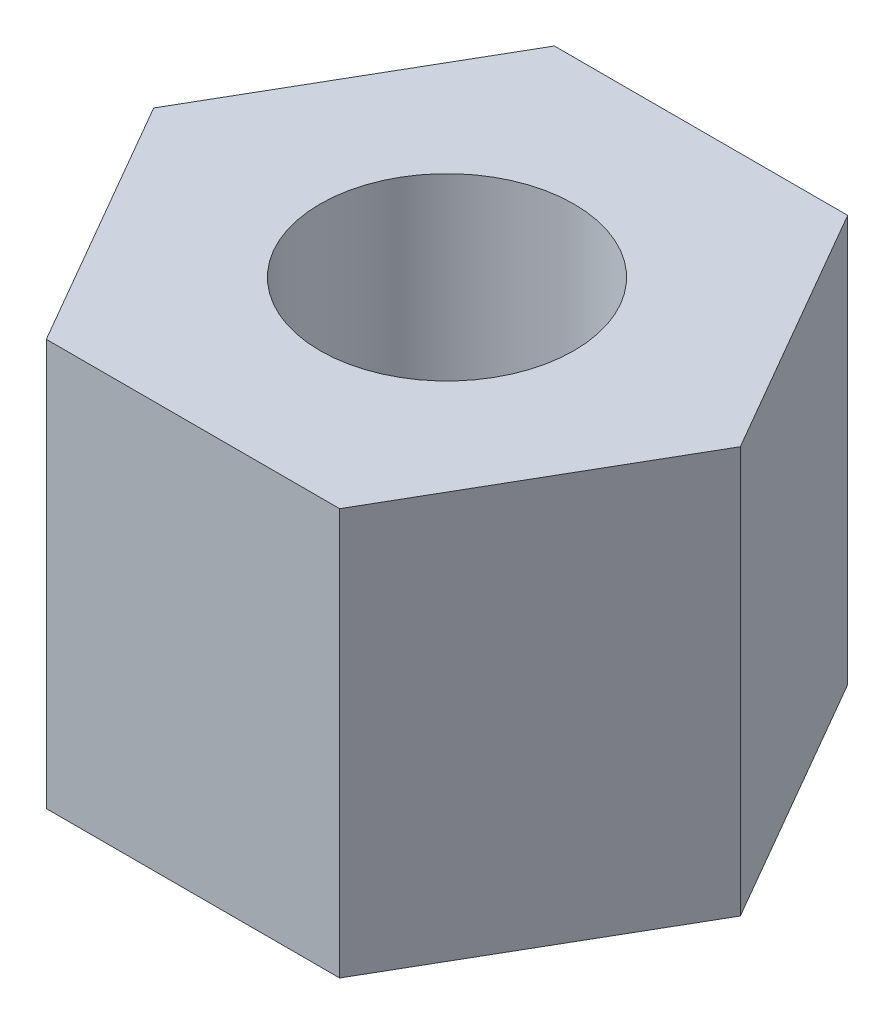
from build123d import *

# Parameters (mm, degrees)
SKETCH_1_R      = 1.25
EXTRUDE_1_DEPTH = 4


with BuildPart() as part:
    # 草图1 → 凸台-拉伸1 (new body)
    with BuildSketch(Plane(origin=(0, 0, 0), x_dir=(1, 0, 0), z_dir=(0, 1, 0))):
        Polygon((1.443375673, -2.5), (2.886751346, 0), (1.443375673, 2.5), (-1.443375673, 2.5), (-2.886751346, 0), (-1.443375673, -2.5), align=None)
        with Locations(Location((0, 0, 0), (0, 0, 270))):
            Circle(SKETCH_1_R, mode=Mode.SUBTRACT)
    extrude(amount=EXTRUDE_1_DEPTH)


solid = part.part
